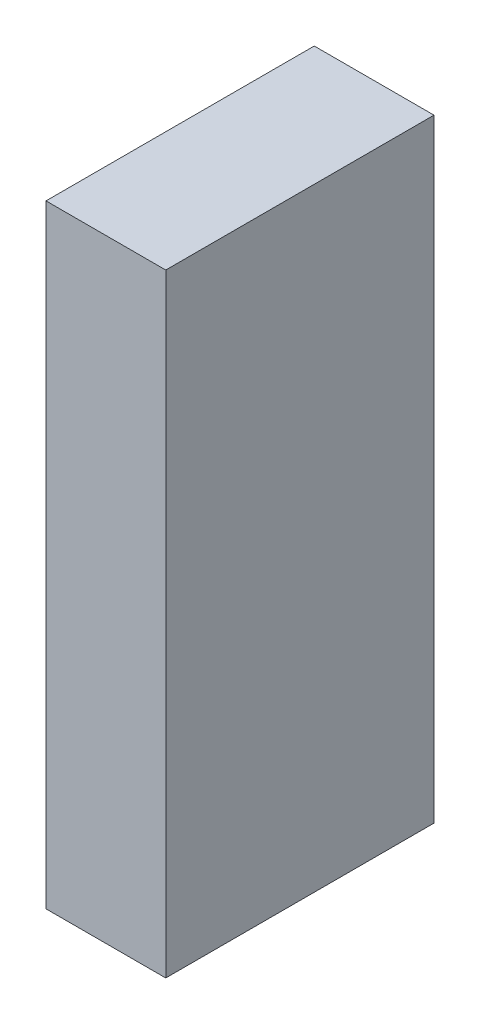
from build123d import *

# Parameters (mm, degrees)
SKETCH1_W           = 25
SKETCH1_H           = 56
BOSS_EXTRUDE1_DEPTH = 128


with BuildPart() as part:
    # Sketch1 → Boss-Extrude1 (new body)
    with BuildSketch(Plane(origin=(0, 0, 0), x_dir=(1, 0, 0), z_dir=(0, 1, 0))):
        Rectangle(SKETCH1_W, SKETCH1_H)
    extrude(amount=BOSS_EXTRUDE1_DEPTH)


solid = part.part
